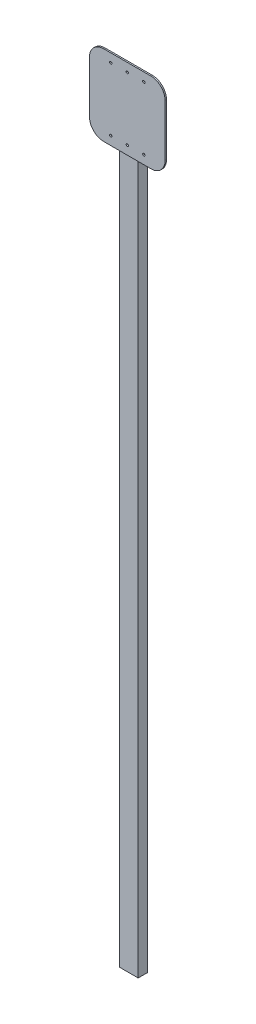
from build123d import *

# Parameters (mm, degrees)
CROQUIS1_R                 = 2.5
SALIENTE_EXTRUIR1_DEPTH    = 3
SALIENTE_EXTRUIR2_DEPTH    = 20
CORTAR_EXTRUIR1_DEPTH      = 99
CORTAR_EXTRUIR1_DEPTH_BACK = 71
CROQUIS3_R                 = 2.5


with BuildPart() as part:
    # Croquis1 → Saliente-Extruir1 (new body)
    with BuildSketch(Plane.XY):
        with BuildLine():
            Line((-50, 85), (50, 85))
            ThreePointArc((50, 85), (71.213203436, 76.213203436), (80, 55))
            Line((80, 55), (80, -55))
            ThreePointArc((80, -55), (71.213203436, -76.213203436), (50, -85))
            Line((50, -85), (-50, -85))
            ThreePointArc((-50, -85), (-71.213203436, -76.213203436), (-80, -55))
            Line((-80, -55), (-80, 55))
            ThreePointArc((-80, 55), (-71.213203436, 76.213203436), (-50, 85))
        make_face()
        with Locations((0, -66.75)):
            Circle(CROQUIS1_R, mode=Mode.SUBTRACT)
        with Locations((0, 66.75)):
            Circle(CROQUIS1_R, mode=Mode.SUBTRACT)
        with Locations((-35, 66.75)):
            Circle(CROQUIS1_R, mode=Mode.SUBTRACT)
        with Locations((35, 66.75)):
            Circle(CROQUIS1_R, mode=Mode.SUBTRACT)
        with Locations((-35, -66.75)):
            Circle(CROQUIS1_R, mode=Mode.SUBTRACT)
        with Locations((35, -66.75)):
            Circle(CROQUIS1_R, mode=Mode.SUBTRACT)
    extrude(amount=SALIENTE_EXTRUIR1_DEPTH)

    # Croquis2 → Saliente-Extruir2 (add)
    with BuildSketch(Plane.XY):
        Polygon((-20, 0), (20, 0), (20, -665), (20, -1584.514762196), (-20, -1584.514762196), (-20, -665), align=None)
    extrude(amount=-SALIENTE_EXTRUIR2_DEPTH)

    # Croquis3 → Cortar-Extruir1 (cut, two sides: drawn at the far end of the back side and taken through both)
    with BuildSketch(Plane.XY.offset(-CORTAR_EXTRUIR1_DEPTH_BACK)):
        with Locations((0, -66.75)):
            Circle(CROQUIS3_R)
    extrude(amount=CORTAR_EXTRUIR1_DEPTH + CORTAR_EXTRUIR1_DEPTH_BACK, mode=Mode.SUBTRACT)


solid = part.part
